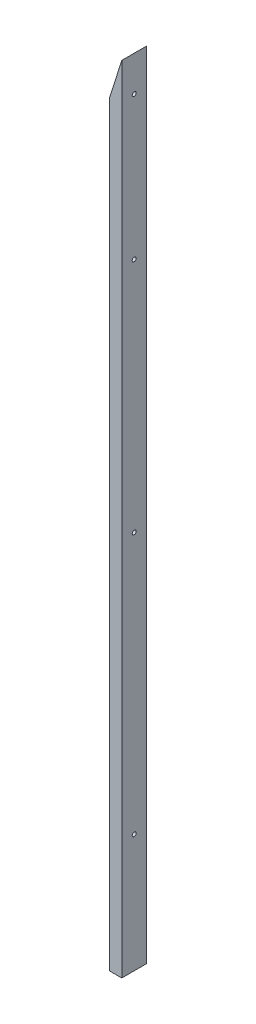
from build123d import *

# Parameters (mm, degrees)
SKETCH_1_W          = 25
SKETCH_1_H          = 50
EXTRUDE_1_DEPTH     = 1600
SKETCH_4_R          = 4
CUT_EXTRUDE_4_DEPTH = 550
CUT_EXTRUDE_5_DEPTH = 60


with BuildPart() as part:
    # Эскиз1 → Бобышка-Вытянуть1 (new body)
    with BuildSketch(Plane(origin=(0, 0, 0), x_dir=(1, 0, 0), z_dir=(0, 1, 0))):
        Rectangle(SKETCH_1_W, SKETCH_1_H)
    extrude(amount=EXTRUDE_1_DEPTH)

    # Эскиз4 → Вырез-Вытянуть4 (cut)
    with BuildSketch(Plane(origin=(12.5, 0, 0), x_dir=(0, 0, -1), z_dir=(1, 0, 0))):
        with Locations((0, 237.5)):
            Circle(SKETCH_4_R)
        with Locations((0, 762.5)):
            Circle(SKETCH_4_R)
        with Locations((0, 1237.5)):
            Circle(SKETCH_4_R)
        with Locations((0, 1525)):
            Circle(SKETCH_4_R)
    extrude(amount=-CUT_EXTRUDE_4_DEPTH, mode=Mode.SUBTRACT)

    # Эскиз5 → Вырез-Вытянуть5 (cut)
    with BuildSketch(Plane.XY.offset(25)):
        Polygon((-12.5, 1600), (-12.5, 1517.37698565), (12.5, 1596.12698565), (12.5, 1600), align=None)
    extrude(amount=-CUT_EXTRUDE_5_DEPTH, mode=Mode.SUBTRACT)


solid = part.part
